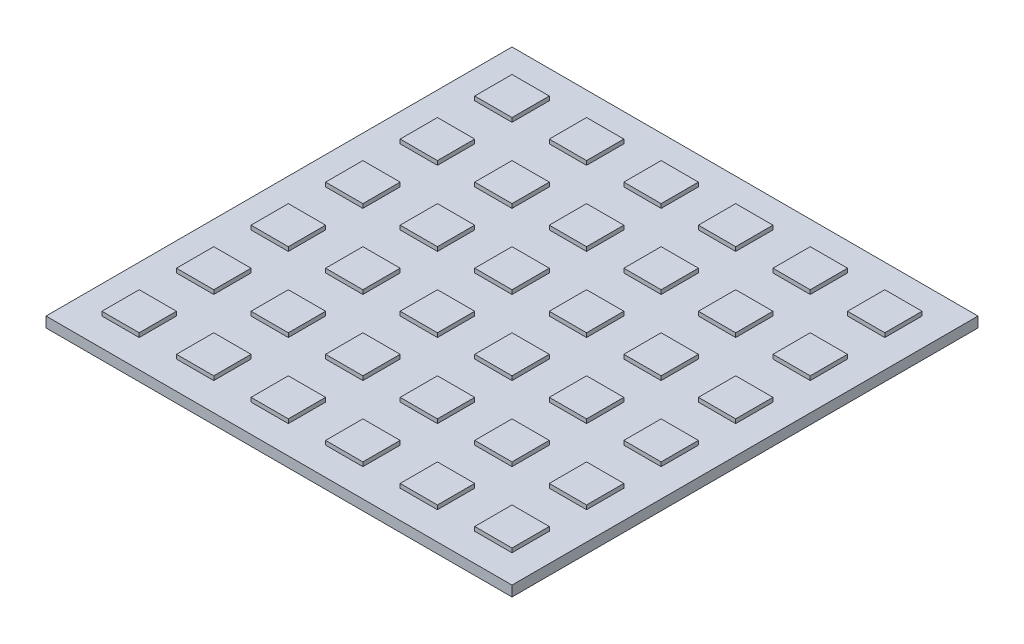
from build123d import *

# Parameters (mm, degrees)
SKETCH1_W            = 225
SKETCH1_H            = 225
BOSS_EXTRUDE1_DEPTH  = 5
SKETCH2_W            = 18
SKETCH2_H            = 18
BOSS_EXTRUDE2_DEPTH  = 2
LPATTERN1_COUNT      = 6
LPATTERN1_PITCH      = 36
LPATTERN1_COUNT_DIR2 = 6
LPATTERN1_PITCH_DIR2 = 36


with BuildPart() as part:
    # Sketch1 → Boss-Extrude1 (new body)
    with BuildSketch(Plane(origin=(0, 0, 0), x_dir=(1, 0, 0), z_dir=(0, 1, 0))):
        Rectangle(SKETCH1_W, SKETCH1_H)
    extrude(amount=BOSS_EXTRUDE1_DEPTH)

    # Sketch2 → Boss-Extrude2 (add)
    with BuildSketch(Plane(origin=(0, 5, 0), x_dir=(1, 0, 0), z_dir=(0, 1, 0))):
        with Locations((-90, 90)):
            Rectangle(SKETCH2_W, SKETCH2_H)
    boss_extrude2 = extrude(amount=BOSS_EXTRUDE2_DEPTH)

    # LPattern1: Boss-Extrude2 6 × 6
    with Locations(*[(i * LPATTERN1_PITCH, 0, j * LPATTERN1_PITCH_DIR2) for i in range(LPATTERN1_COUNT) for j in range(LPATTERN1_COUNT_DIR2) if (i, j) != (0, 0)]):
        add(boss_extrude2)


solid = part.part
